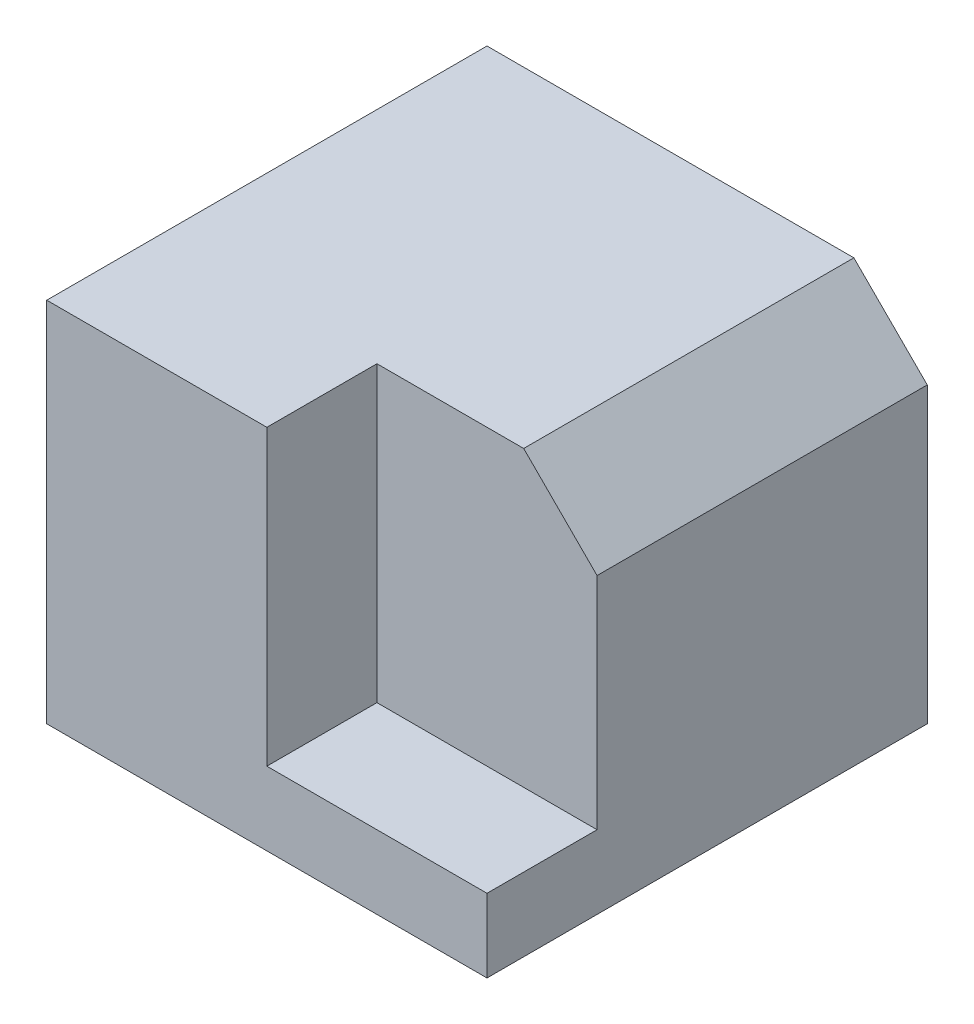
from build123d import *

# Parameters (mm, degrees)
SKETCH1_W      = 60
SKETCH1_H      = 60
EXTRUDE1_DEPTH = 50
SKETCH2_W      = 30
SKETCH2_H      = 15
EXTRUDE2_DEPTH = 40
CHAMFER1_SIZE  = 10


with BuildPart() as part:
    # Sketch1 → Extrude1 (new body)
    with BuildSketch(Plane(origin=(0, 0, 0), x_dir=(1, 0, 0), z_dir=(0, 1, 0))):
        Rectangle(SKETCH1_W, SKETCH1_H)
    extrude(amount=EXTRUDE1_DEPTH)

    # Sketch2 → Extrude2 (cut)
    with BuildSketch(Plane(origin=(0, 50, 0), x_dir=(1, 0, 0), z_dir=(0, 1, 0))):
        with Locations((15, -22.5)):
            Rectangle(SKETCH2_W, SKETCH2_H)
    extrude(amount=-EXTRUDE2_DEPTH, mode=Mode.SUBTRACT)

    # Chamfer1
    chamfer1_edges = [part.edges().sort_by_distance(p)[0] for p in [
        (30, 50, -7.5),
    ]]
    chamfer(chamfer1_edges, length=CHAMFER1_SIZE)


solid = part.part
